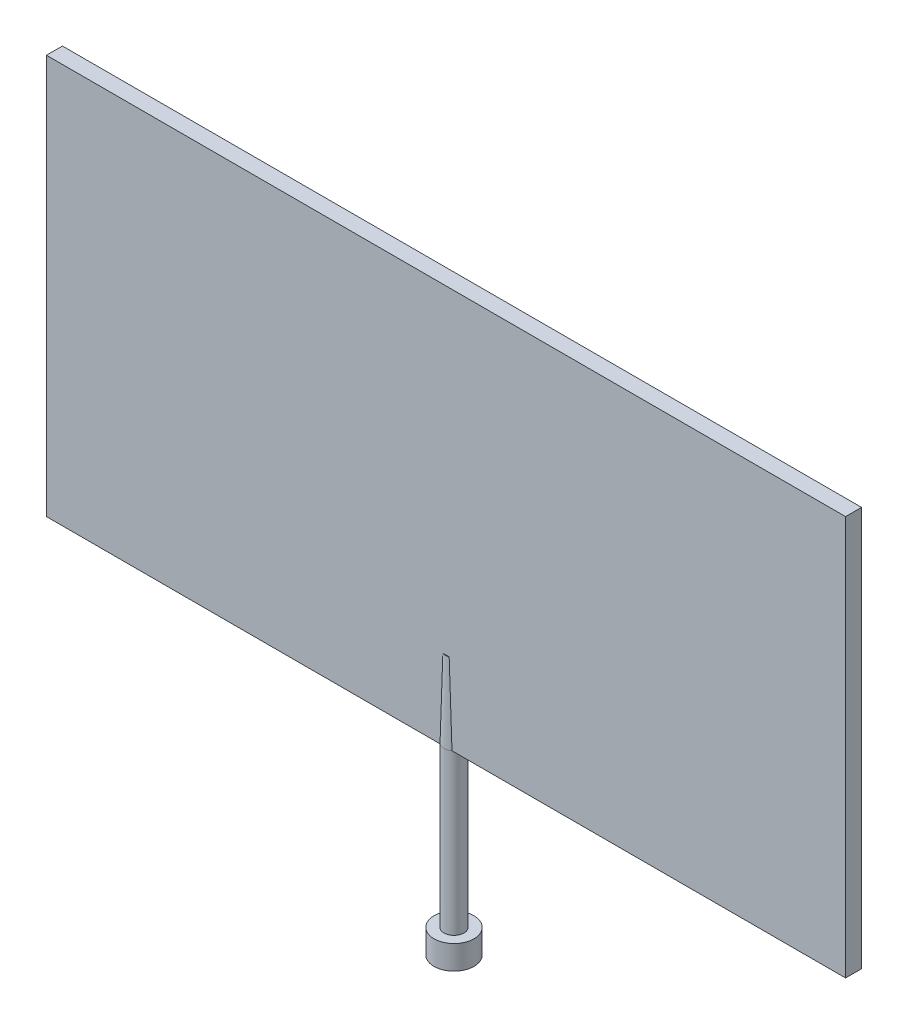
from build123d import *

# Parameters (mm, degrees)
SKETCH1_W           = 100
SKETCH1_H           = 2
BOSS_EXTRUDE1_DEPTH = 50
SKETCH2_R           = 1.25
BOSS_EXTRUDE2_DEPTH = 10
BOSS_EXTRUDE2_DRAFT = -1
SKETCH3_R           = 1.25
BOSS_EXTRUDE3_DEPTH = 20
SKETCH4_R           = 2.499001264
SKETCH4_R_2         = 1.25
BOSS_EXTRUDE4_DEPTH = 3


with BuildPart() as part:
    # Sketch1 → Boss-Extrude1 (new body)
    with BuildSketch(Plane(origin=(0, 0, 0), x_dir=(1, 0, 0), z_dir=(0, 1, 0))):
        with Locations((-26.25, 13.375)):
            Rectangle(SKETCH1_W, SKETCH1_H)
    extrude(amount=BOSS_EXTRUDE1_DEPTH)


with BuildPart() as boss_extrude2_tool:
    # Sketch2 → Boss-Extrude2 (with draft: the straight prism first)
    with BuildSketch(Plane.XZ):
        with Locations((-26.25, -13.375)):
            Circle(SKETCH2_R)
    extrude(amount=-BOSS_EXTRUDE2_DEPTH)
    # Boss-Extrude2: the draft: its side faces are tilted about the plane it starts from
    boss_extrude2_sides = [boss_extrude2_tool.faces().sort_by_distance(p)[0] for p in [
        (-27.5, 5, -13.375),
    ]]
    draft(boss_extrude2_sides, Plane.XZ, BOSS_EXTRUDE2_DRAFT)


with BuildPart() as part_1:
    add(part.part)

    # Boss-Extrude2: add boss_extrude2_tool
    add(boss_extrude2_tool.part)

    # Sketch3 → Boss-Extrude3 (add)
    with BuildSketch(Plane.XZ):
        with Locations(Location((-26.25, -13.375, 0), (0, 0, 53.130102354))):
            Circle(SKETCH3_R)
    extrude(amount=BOSS_EXTRUDE3_DEPTH)


with BuildPart() as body_2:
    # Sketch4 → Boss-Extrude4 (new body)
    with BuildSketch(Plane.XZ.offset(20)):
        with Locations(Location((-26.25, -13.375, 0), (0, 0, 90))):
            Circle(SKETCH4_R)
        with Locations(Location((-26.25, -13.375, 0), (0, 0, 90))):
            Circle(SKETCH4_R_2, mode=Mode.SUBTRACT)
    extrude(amount=BOSS_EXTRUDE4_DEPTH)


solid = Compound([part_1.part, body_2.part])
